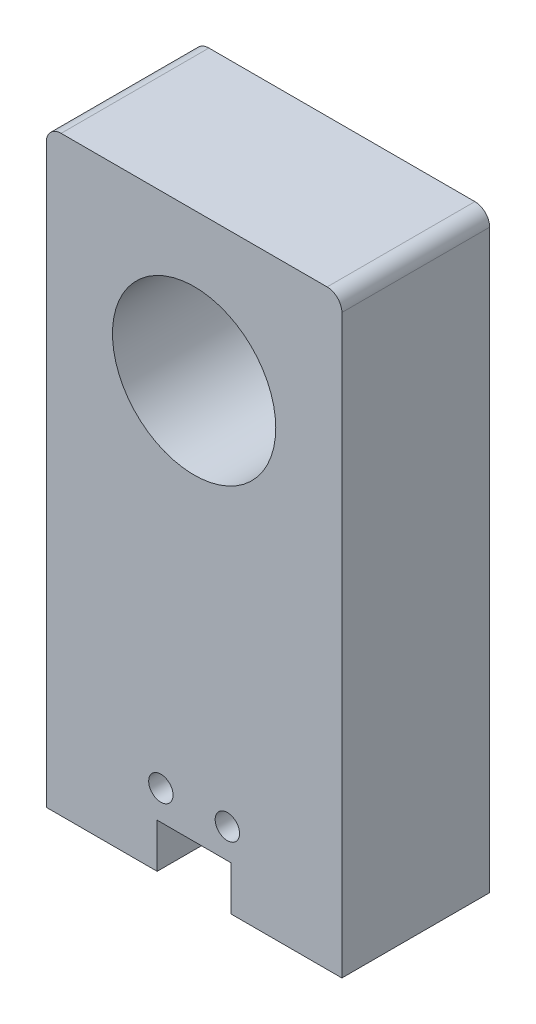
from build123d import *

# Parameters (mm, degrees)
SKETCH_1_W          = 40
SKETCH_1_H          = 40
EXTRUDE_1_DEPTH     = 20
SKETCH_2_R          = 11.05
CUT_EXTRUDE_1_DEPTH = 20
SKETCH_3_W          = 40
SKETCH_3_H          = 20
EXTRUDE_2_DEPTH     = 40
SKETCH_4_R          = 1.65
CUT_EXTRUDE_2_DEPTH = 40
SKETCH_5_W          = 10
SKETCH_5_H          = 12
CUT_EXTRUDE_3_DEPTH = 6
FILLET_1_R          = 2


with BuildPart() as part:
    # 草图1 → 凸台-拉伸1 (new body)
    with BuildSketch(Plane.XY):
        Rectangle(SKETCH_1_W, SKETCH_1_H)
    extrude(amount=EXTRUDE_1_DEPTH)

    # 草图2 → 切除-拉伸1 (cut)
    with BuildSketch(Plane.XY.offset(20)):
        Circle(SKETCH_2_R)
    extrude(amount=-CUT_EXTRUDE_1_DEPTH, mode=Mode.SUBTRACT)

    # 草图3 → 凸台-拉伸2 (add)
    with BuildSketch(Plane.XZ.offset(20)):
        with Locations((0, 10)):
            Rectangle(SKETCH_3_W, SKETCH_3_H)
    extrude(amount=EXTRUDE_2_DEPTH)

    # 草图4 → 切除-拉伸2 (cut)
    with BuildSketch(Plane.XY.offset(20)):
        with Locations((4.5, -50)):
            Circle(SKETCH_4_R)
        with Locations((-4.5, -50)):
            Circle(SKETCH_4_R)
    extrude(amount=-CUT_EXTRUDE_2_DEPTH, mode=Mode.SUBTRACT)

    # 草图5 → 切除-拉伸3 (cut)
    with BuildSketch(Plane.XZ.offset(60)):
        with Locations((0, 14)):
            Rectangle(SKETCH_5_W, SKETCH_5_H)
    extrude(amount=-CUT_EXTRUDE_3_DEPTH, mode=Mode.SUBTRACT)

    # 圆角1
    fillet_1_edges = [part.edges().sort_by_distance(p)[0] for p in [
        (-20, 20, 10),
        (20, 20, 10),
    ]]
    fillet(fillet_1_edges, radius=FILLET_1_R)


solid = part.part
